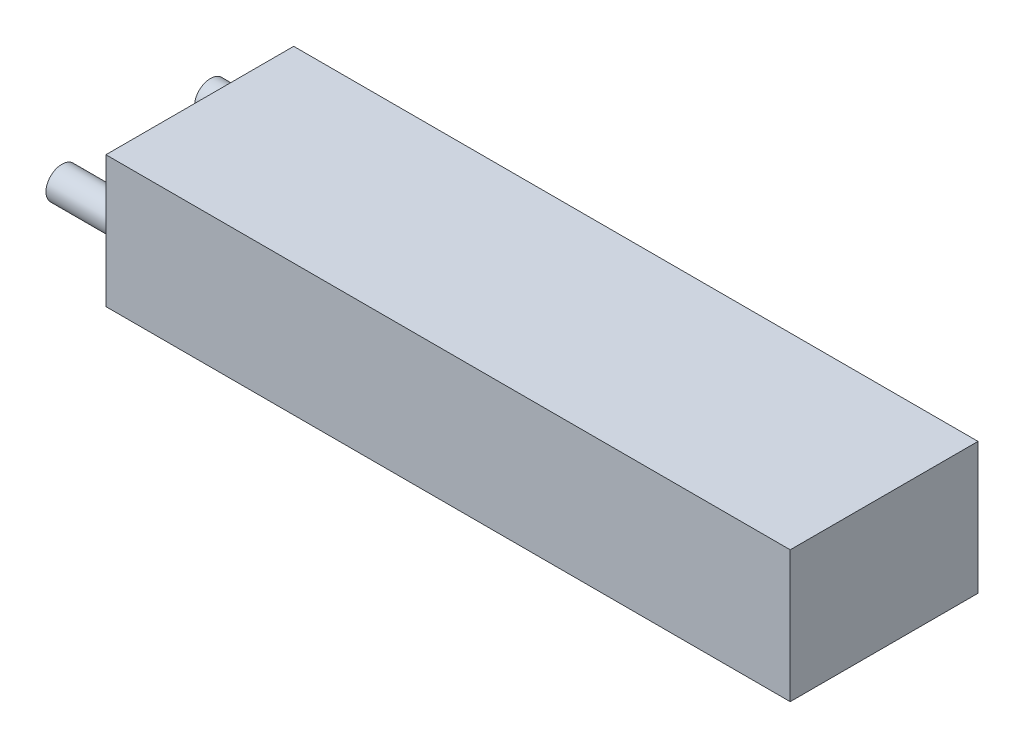
from build123d import *

# Parameters (mm, degrees)
SKETCH1_W           = 64.5
SKETCH1_H           = 17.7
BOSS_EXTRUDE1_DEPTH = 6.2
SKETCH2_R           = 1.5
BOSS_EXTRUDE2_DEPTH = 6


with BuildPart() as part:
    # Sketch1 → Boss-Extrude1 (new, symmetric)
    with BuildSketch(Plane(origin=(0, 0, 0), x_dir=(1, 0, 0), z_dir=(0, 1, 0))):
        Rectangle(SKETCH1_W, SKETCH1_H)
    extrude(amount=BOSS_EXTRUDE1_DEPTH, both=True)

    # Sketch2 → Boss-Extrude2 (add, symmetric)
    with BuildSketch(Plane.ZY.offset(32.25)):
        with Locations(Location((-7, 0, 0), (0, 0, 180))):
            Circle(SKETCH2_R)
        with Locations(Location((7, 0, 0), (0, 0, 180))):
            Circle(SKETCH2_R)
    extrude(amount=BOSS_EXTRUDE2_DEPTH, both=True)


solid = part.part
